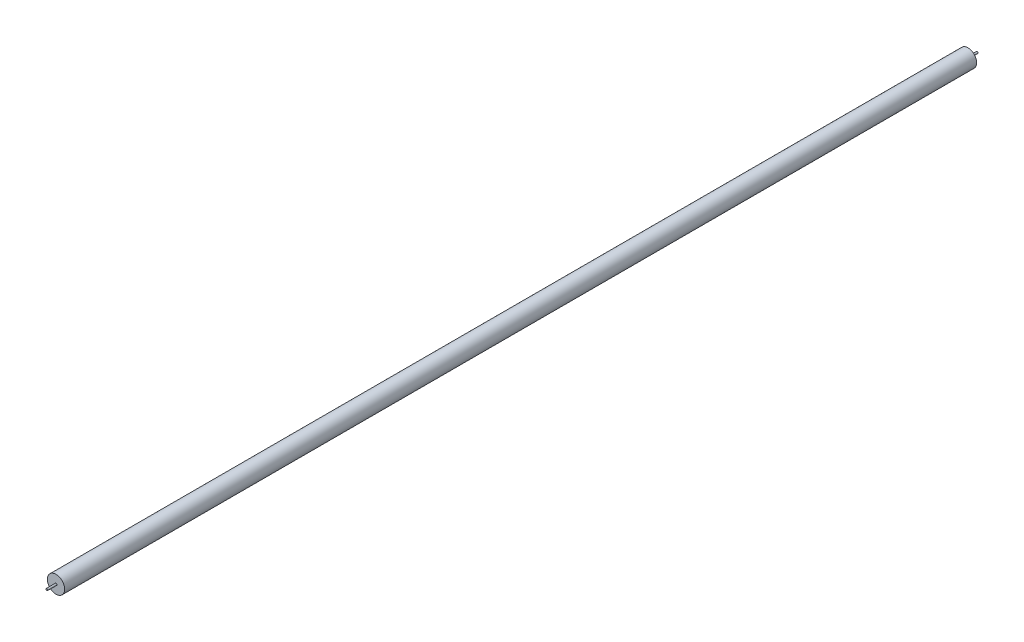
from build123d import *

# Parameters (mm, degrees)
SKETCH1_R           = 4.75
BOSS_EXTRUDE1_DEPTH = 502
SKETCH2_R           = 0.5
BOSS_EXTRUDE2_DEPTH = 5
BOSS_EXTRUDE3_START = 5
SKETCH3_R           = 0.5
BOSS_EXTRUDE3_DEPTH = 5


with BuildPart() as part:
    # Sketch1 → Boss-Extrude1 (new body)
    with BuildSketch(Plane.XY):
        Circle(SKETCH1_R)
    extrude(amount=BOSS_EXTRUDE1_DEPTH)

    # Sketch2 → Boss-Extrude2 (add)
    with BuildSketch(Plane(origin=(0, 0, 0), x_dir=(-1, 0, 0), z_dir=(0, 0, -1))):
        with Locations(Location((0, 0, 0), (0, 0, 180))):
            Circle(SKETCH2_R)
    extrude(amount=BOSS_EXTRUDE2_DEPTH)

    # Sketch3 → Boss-Extrude3 (add)
    with BuildSketch(Plane.XY.offset(502).offset(BOSS_EXTRUDE3_START)):
        Circle(SKETCH3_R)
    extrude(amount=-BOSS_EXTRUDE3_DEPTH)


solid = part.part
